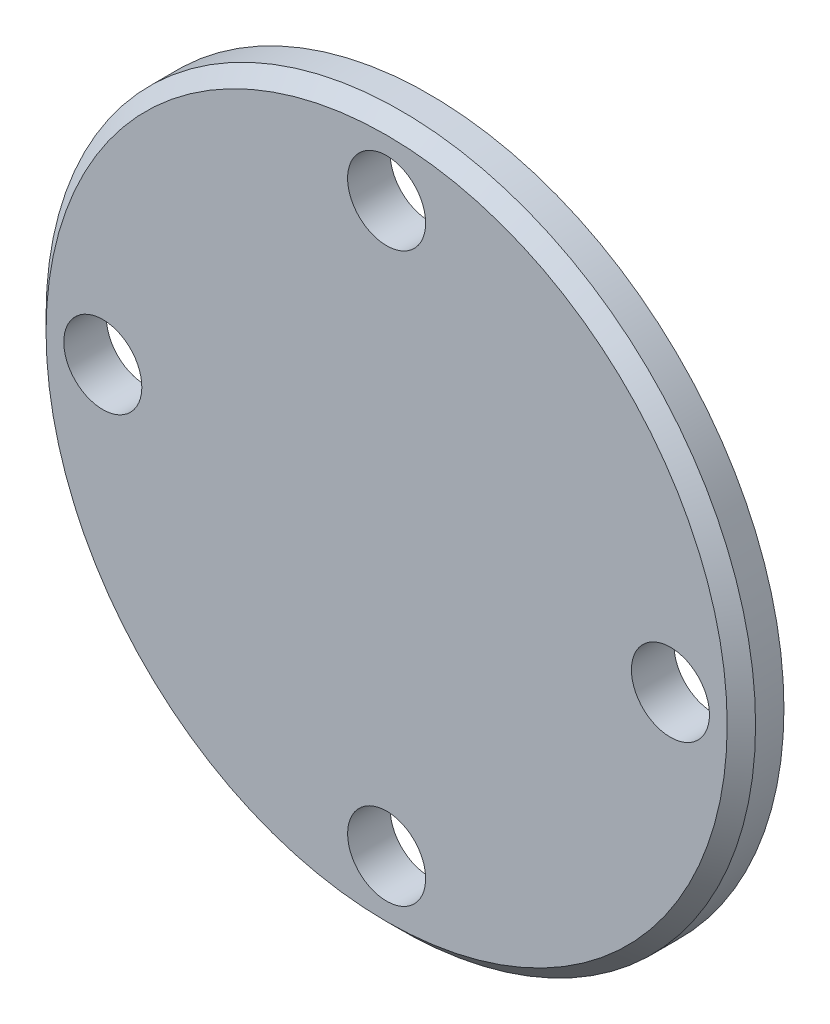
from build123d import *

# Parameters (mm, degrees)
SKETCH_1_R               = 25
EXTRUDE_1_DEPTH          = 3
CHAMFER_1_SIZE           = 1
SKETCH_2_R               = 2.75
CUT_EXTRUDE_1_DEPTH      = 36.482389998
PATTERN_CIRCULAR_1_COUNT = 4


with BuildPart() as part:
    # 草图1 → 凸台-拉伸1 (new body)
    with BuildSketch(Plane.XY):
        Circle(SKETCH_1_R)
    extrude(amount=EXTRUDE_1_DEPTH)

    # 倒角1
    chamfer_1_edges = [part.edges().sort_by_distance(p)[0] for p in [
        (-25, 0, 3),
    ]]
    chamfer(chamfer_1_edges, length=CHAMFER_1_SIZE)

    # 草图2 → 切除-拉伸1 (cut, through all)
    with BuildSketch(Plane.XY.offset(3)):
        with Locations((0, 20)):
            Circle(SKETCH_2_R)
    cut_extrude_1 = extrude(amount=-CUT_EXTRUDE_1_DEPTH, mode=Mode.SUBTRACT)

    # 阵列(圆周)1: 切除-拉伸1 ×4 about axis
    pattern_circular_1_axis = Axis((0, 0, 0), (0, 0, 1))
    for i in range(1, PATTERN_CIRCULAR_1_COUNT):
        add(cut_extrude_1.rotate(pattern_circular_1_axis, i * 360 / PATTERN_CIRCULAR_1_COUNT), mode=Mode.SUBTRACT)


solid = part.part
